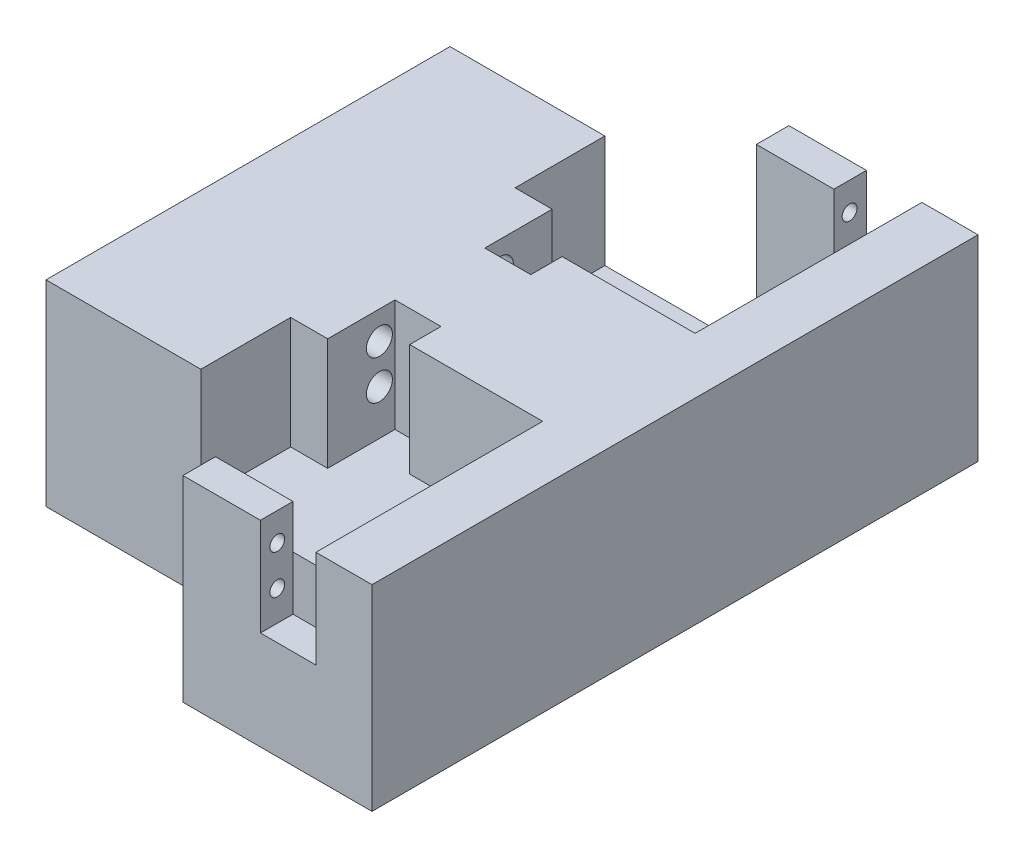
from build123d import *

# Parameters (mm, degrees)
SKETCH1_W           = 88.9
SKETCH1_H           = 91.44
BOSS_EXTRUDE1_DEPTH = 44.45
SKETCH2_W           = 8.382
SKETCH2_H           = 20.32
CUT_EXTRUDE1_DEPTH  = 25.4
BOSS_EXTRUDE2_DEPTH = 44.45
SKETCH4_R           = 1.6764
CUT_EXTRUDE4_DEPTH  = 22.098
SKETCH5_R           = 2.9464
CUT_EXTRUDE6_DEPTH  = 43.434
SKETCH7_W           = 12.552336234
SKETCH7_H           = 7.366
CUT_EXTRUDE7_DEPTH  = 22.098


with BuildPart() as part:
    # Sketch1 → Boss-Extrude1 (new body)
    with BuildSketch(Plane(origin=(0, 0, 0), x_dir=(1, 0, 0), z_dir=(0, 1, 0))):
        Rectangle(SKETCH1_W, SKETCH1_H)
    extrude(amount=BOSS_EXTRUDE1_DEPTH)

    # Sketch2 → Cut-Extrude1 (cut)
    with BuildSketch(Plane(origin=(0, 44.45, 0), x_dir=(1, 0, 0), z_dir=(0, 1, 0))):
        with Locations((-5.207, -35.56)):
            Rectangle(SKETCH2_W, SKETCH2_H)
        Polygon((-1.016, -45.72), (39.497, -45.72), (39.497, -17.2466), (9.398, -17.2466), (9.398, -10.16), (-1.016, -10.16), (-1.016, -25.4), align=None)
        Polygon((39.497, 17.2466), (39.497, 45.72), (-1.016, 45.72), (-1.016, 25.4), (-1.016, 10.16), (9.398, 10.16), (9.398, 17.2466), align=None)
        with Locations((-5.207, 35.56)):
            Rectangle(SKETCH2_W, SKETCH2_H)
    extrude(amount=-CUT_EXTRUDE1_DEPTH, mode=Mode.SUBTRACT)

    # Sketch3 → Boss-Extrude2 (add)
    with BuildSketch(Plane(origin=(0, 44.45, 0), x_dir=(1, 0, 0), z_dir=(0, 1, 0))):
        Polygon((52.197, -68.58), (52.197, 68.58), (9.398, 68.58), (9.398, 61.214), (39.497, 61.214), (39.497, 45.72), (44.45, 45.72), (44.45, -45.72), (39.497, -45.72), (39.497, -61.214), (9.398, -61.214), (9.398, -68.58), align=None)
    extrude(amount=-BOSS_EXTRUDE2_DEPTH)

    # Sketch4 → Cut-Extrude4 (cut)
    with BuildSketch(Plane.ZY.offset(-9.398)):
        with Locations((-64.77, 29.21)):
            Circle(SKETCH4_R)
        with Locations((-64.77, 38.1)):
            Circle(SKETCH4_R)
        with Locations((-13.6906, 38.1)):
            Circle(SKETCH4_R)
        with Locations((-13.6906, 29.21)):
            Circle(SKETCH4_R)
        with Locations((13.6906, 38.1)):
            Circle(SKETCH4_R)
        with Locations((13.6906, 29.21)):
            Circle(SKETCH4_R)
        with Locations((64.77, 38.1)):
            Circle(SKETCH4_R)
        with Locations((64.77, 29.21)):
            Circle(SKETCH4_R)
    extrude(amount=-CUT_EXTRUDE4_DEPTH, mode=Mode.SUBTRACT)

    # Sketch5 → Cut-Extrude6 (cut)
    with BuildSketch(Plane.ZY.offset(44.45)):
        with Locations((-13.6906, 38.1)):
            Circle(SKETCH5_R)
        with Locations((-13.6906, 29.21)):
            Circle(SKETCH5_R)
        with Locations((13.6906, 38.1)):
            Circle(SKETCH5_R)
        with Locations((13.6906, 29.21)):
            Circle(SKETCH5_R)
    extrude(amount=-CUT_EXTRUDE6_DEPTH, mode=Mode.SUBTRACT)

    # Sketch7 → Cut-Extrude7 (cut)
    with BuildSketch(Plane(origin=(0, 44.45, 0), x_dir=(1, 0, 0), z_dir=(0, 1, 0))):
        with Locations((33.220831883, -64.897)):
            Rectangle(SKETCH7_W, SKETCH7_H)
        with Locations((33.220831883, 64.897)):
            Rectangle(SKETCH7_W, SKETCH7_H)
    extrude(amount=-CUT_EXTRUDE7_DEPTH, mode=Mode.SUBTRACT)


solid = part.part
